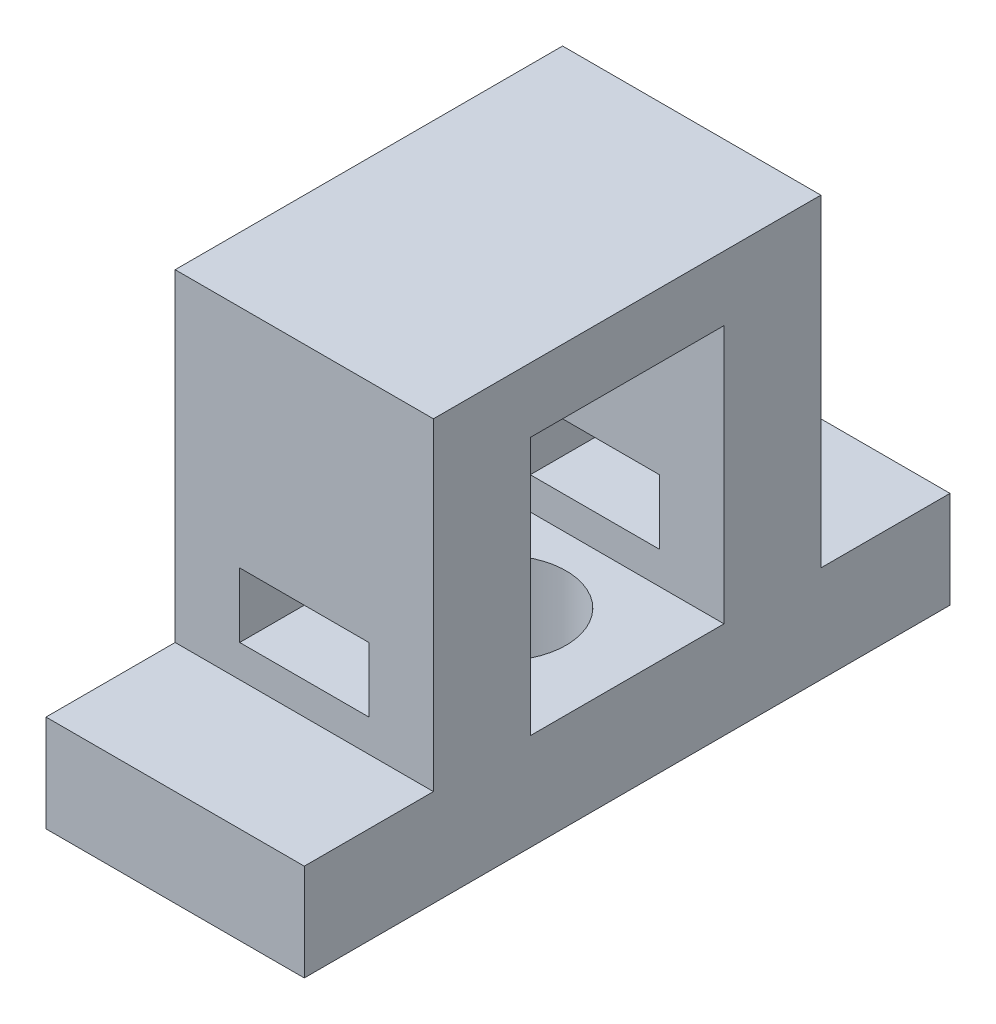
from build123d import *

# Parameters (mm, degrees)
SKETCH1_W           = 30
SKETCH1_H           = 40
BOSS_EXTRUDE1_DEPTH = 40
SKETCH2_W           = 20
SKETCH2_H           = 10
CUT_EXTRUDE1_DEPTH  = 107.082782983
SKETCH3_R           = 10
CUT_EXTRUDE2_DEPTH  = 109.757771635


with BuildPart() as part:
    # Sketch1 → Boss-Extrude1 (new body)
    with BuildSketch(Plane(origin=(0, 0, 0), x_dir=(0, 0, -1), z_dir=(1, 0, 0))):
        Polygon((-12.089517741, -57.039958323), (-12.089517741, -42.039958323), (7.910482259, -42.039958323), (7.910482259, 7.960041677), (67.910482259, 7.960041677), (67.910482259, -42.039958323), (87.910482259, -42.039958323), (87.910482259, -57.039958323), align=None)
        with Locations((37.910482259, -22.039958323)):
            Rectangle(SKETCH1_W, SKETCH1_H, mode=Mode.SUBTRACT)
    extrude(amount=BOSS_EXTRUDE1_DEPTH)

    # Sketch2 → Cut-Extrude1 (cut, through all)
    with BuildSketch(Plane.XY.offset(-7.910482259)):
        with Locations((20, -32.039958323)):
            Rectangle(SKETCH2_W, SKETCH2_H)
    extrude(amount=-CUT_EXTRUDE1_DEPTH, mode=Mode.SUBTRACT)

    # Sketch3 → Cut-Extrude2 (cut, through all)
    with BuildSketch(Plane(origin=(0, -42.039958323, 0), x_dir=(1, 0, 0), z_dir=(0, 1, 0))):
        with Locations(Location((20.652222237, 37.801778553, 0), (0, 0, 270))):
            Circle(SKETCH3_R)
    extrude(amount=-CUT_EXTRUDE2_DEPTH, mode=Mode.SUBTRACT)


solid = part.part
